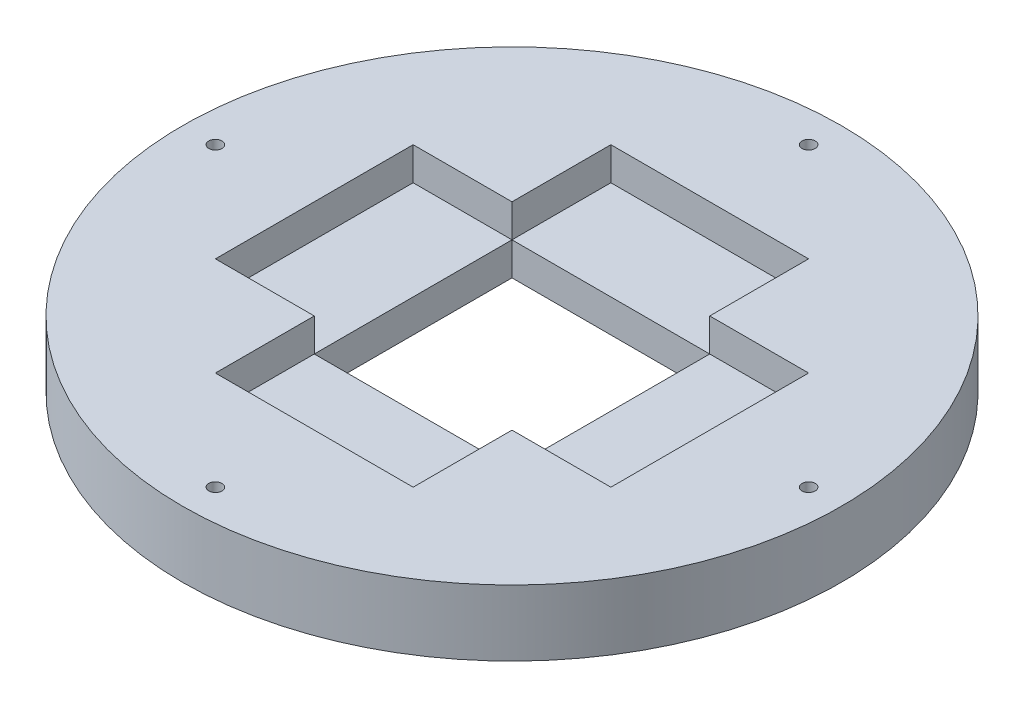
from build123d import *

# Parameters (mm, degrees)
ESQUISSE2_R             = 100
ESQUISSE2_W             = 60
ESQUISSE2_H             = 60
BOSS_EXTRU_6_DEPTH      = 20
ESQUISSE3_W             = 60
ESQUISSE3_H             = 30
ESQUISSE3_W_2           = 30
ESQUISSE3_H_2           = 60
ENL_V_MAT_EXTRU_7_DEPTH = 10
ESQUISSE7_R             = 2
ENL_V_MAT_EXTRU_8_DEPTH = 20


with BuildPart() as part:
    # Esquisse2 → Boss.-Extru.6 (new body)
    with BuildSketch(Plane(origin=(0, 0, 0), x_dir=(1, 0, 0), z_dir=(0, 1, 0))):
        with Locations(Location((0, 0, 0), (0, 0, 270))):
            Circle(ESQUISSE2_R)
        Rectangle(ESQUISSE2_W, ESQUISSE2_H, mode=Mode.SUBTRACT)
    extrude(amount=BOSS_EXTRU_6_DEPTH)

    # Esquisse3 → Enlèv. mat.-Extru.7 (cut)
    with BuildSketch(Plane(origin=(0, 20, 0), x_dir=(1, 0, 0), z_dir=(0, 1, 0))):
        with Locations((0, 45)):
            Rectangle(ESQUISSE3_W, ESQUISSE3_H)
        with Locations((45, 0)):
            Rectangle(ESQUISSE3_W_2, ESQUISSE3_H_2)
        with Locations((0, -45)):
            Rectangle(ESQUISSE3_W, ESQUISSE3_H)
        with Locations((-45, 0)):
            Rectangle(ESQUISSE3_W_2, ESQUISSE3_H_2)
    extrude(amount=-ENL_V_MAT_EXTRU_7_DEPTH, mode=Mode.SUBTRACT)

    # Esquisse7 → Enlèv. mat.-Extru.8 (cut)
    with BuildSketch(Plane(origin=(0, 20, 0), x_dir=(1, 0, 0), z_dir=(0, 1, 0))):
        with Locations(Location((0, 90, 0), (0, 0, 270))):
            Circle(ESQUISSE7_R)
        with Locations(Location((90, 0, 0), (0, 0, 270))):
            Circle(ESQUISSE7_R)
        with Locations(Location((0, -90, 0), (0, 0, 270))):
            Circle(ESQUISSE7_R)
        with Locations(Location((-90, 0, 0), (0, 0, 270))):
            Circle(ESQUISSE7_R)
    extrude(amount=-ENL_V_MAT_EXTRU_8_DEPTH, mode=Mode.SUBTRACT)


solid = part.part
